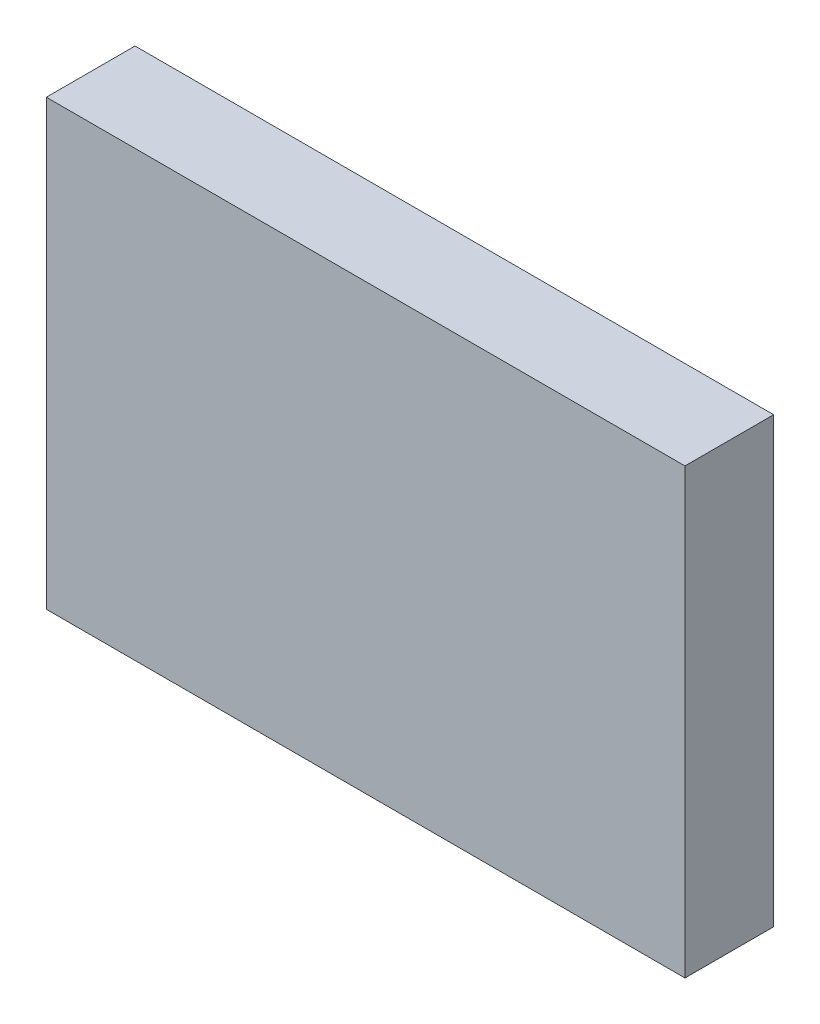
from build123d import *

# Parameters (mm, degrees)
SKETCH_1_W      = 72
SKETCH_1_H      = 50
EXTRUDE_1_DEPTH = 10


with BuildPart() as part:
    # 草图1 → 凸台-拉伸1 (new body)
    with BuildSketch(Plane.XY):
        with Locations((36, 25)):
            Rectangle(SKETCH_1_W, SKETCH_1_H)
    extrude(amount=EXTRUDE_1_DEPTH)


solid = part.part
